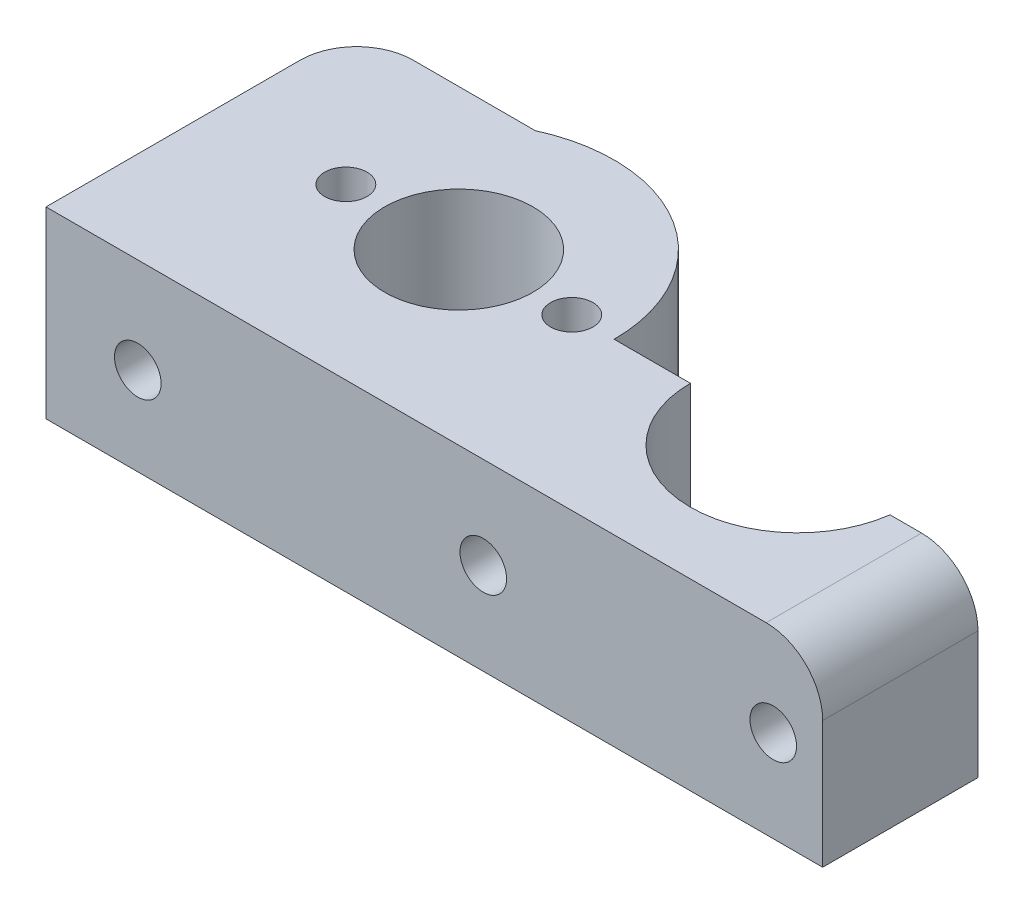
from build123d import *

# Parameters (mm, degrees)
SKETCH1_R               = 1.5
SKETCH1_R_2             = 5.25
BOSS_EXTRUDE4_DEPTH     = 13
FILLET2_R               = 4
CUT_EXTRUDE1_DEPTH      = 40.402671632
CUT_EXTRUDE1_DEPTH_BACK = 40.402671632
SKETCH2_R               = 1.65
FILLET3_R               = 4


with BuildPart() as part:
    # Sketch1 → Boss-Extrude4 (new body)
    with BuildSketch(Plane(origin=(0, 0, 0), x_dir=(1, 0, 0), z_dir=(0, 1, 0))):
        with BuildLine():
            Line((-29.23303836, -12), (25.76696164, -12))
            Line((25.76696164, -12), (25.76696164, -1))
            Line((25.76696164, -1), (19.533923281, -1))
            ThreePointArc((19.533923281, -1), (11.498909656, -7.583462828), (4.4, 0))
            Line((4.4, 0), (-1, 0))
            ThreePointArc((-1, 0), (-6.058970318, 9.257654472), (-16.582575695, 10))
            Line((-16.582575695, 10), (-29.23303836, 10))
            Line((-29.23303836, 10), (-29.23303836, -12))
        make_face()
        with Locations((-4, 0)):
            Circle(SKETCH1_R, mode=Mode.SUBTRACT)
        with Locations((-20, 0)):
            Circle(SKETCH1_R, mode=Mode.SUBTRACT)
        with Locations((-12, 0)):
            Circle(SKETCH1_R_2, mode=Mode.SUBTRACT)
    extrude(amount=BOSS_EXTRUDE4_DEPTH)

    # Fillet2
    fillet2_edges = [part.edges().sort_by_distance(p)[0] for p in [
        (25.76696164, 13, 6.5),
    ]]
    fillet(fillet2_edges, radius=FILLET2_R)

    # Sketch2 → Cut-Extrude1 (cut, two sides: drawn at the far end of the back side and taken through both)
    with BuildSketch(Plane.XY.offset(12).offset(-CUT_EXTRUDE1_DEPTH_BACK)):
        with Locations((22.26696164, 6.5)):
            Circle(SKETCH2_R)
        with Locations((1.73303836, 6.5)):
            Circle(SKETCH2_R)
        with Locations((-22.73303836, 6.238089535)):
            Circle(SKETCH2_R)
    extrude(amount=CUT_EXTRUDE1_DEPTH + CUT_EXTRUDE1_DEPTH_BACK, mode=Mode.SUBTRACT)

    # Fillet3
    fillet3_edges = [part.edges().sort_by_distance(p)[0] for p in [
        (-29.23303836, 6.5, -10),
    ]]
    fillet(fillet3_edges, radius=FILLET3_R)


solid = part.part
